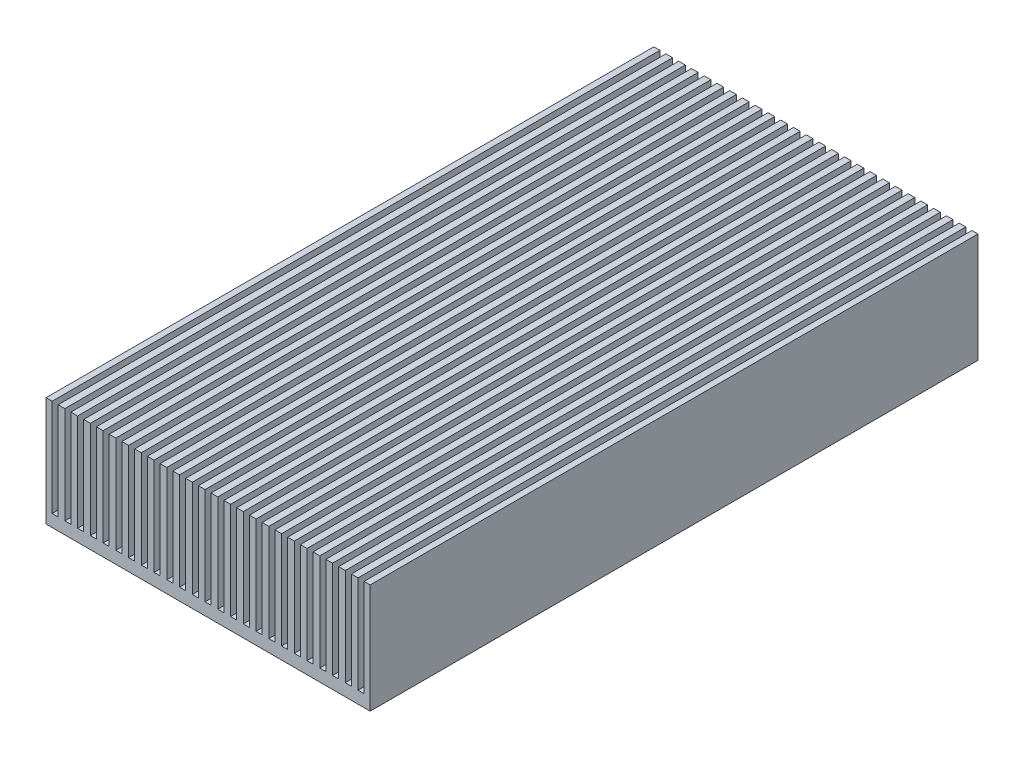
from build123d import *

# Parameters (mm, degrees)
SKETCH1_W           = 80
SKETCH1_H           = 150
BOSS_EXTRUDE1_DEPTH = 27
SKETCH2_W           = 1.5
SKETCH2_H           = 150
CUT_EXTRUDE1_DEPTH  = 24


with BuildPart() as part:
    # Sketch1 → Boss-Extrude1 (new body)
    with BuildSketch(Plane(origin=(0, 0, 0), x_dir=(1, 0, 0), z_dir=(0, 1, 0))):
        with Locations((40, 75)):
            Rectangle(SKETCH1_W, SKETCH1_H)
    extrude(amount=BOSS_EXTRUDE1_DEPTH)

    # Sketch2 → Cut-Extrude1 (cut)
    with BuildSketch(Plane(origin=(0, 27, 0), x_dir=(1, 0, 0), z_dir=(0, 1, 0))):
        with Locations((2.25, 75)):
            Rectangle(SKETCH2_W, SKETCH2_H)
        with Locations((5.395833333, 75)):
            Rectangle(SKETCH2_W, SKETCH2_H)
        with Locations((8.541666667, 75)):
            Rectangle(SKETCH2_W, SKETCH2_H)
        with Locations((11.6875, 75)):
            Rectangle(SKETCH2_W, SKETCH2_H)
        with Locations((14.833333333, 75)):
            Rectangle(SKETCH2_W, SKETCH2_H)
        with Locations((17.979166667, 75)):
            Rectangle(SKETCH2_W, SKETCH2_H)
        with Locations((21.125, 75)):
            Rectangle(SKETCH2_W, SKETCH2_H)
        with Locations((24.270833333, 75)):
            Rectangle(SKETCH2_W, SKETCH2_H)
        with Locations((27.416666667, 75)):
            Rectangle(SKETCH2_W, SKETCH2_H)
        with Locations((30.5625, 75)):
            Rectangle(SKETCH2_W, SKETCH2_H)
        with Locations((33.708333333, 75)):
            Rectangle(SKETCH2_W, SKETCH2_H)
        with Locations((36.854166667, 75)):
            Rectangle(SKETCH2_W, SKETCH2_H)
        with Locations((40, 75)):
            Rectangle(SKETCH2_W, SKETCH2_H)
        with Locations((43.145833333, 75)):
            Rectangle(SKETCH2_W, SKETCH2_H)
        with Locations((46.291666667, 75)):
            Rectangle(SKETCH2_W, SKETCH2_H)
        with Locations((49.4375, 75)):
            Rectangle(SKETCH2_W, SKETCH2_H)
        with Locations((52.583333333, 75)):
            Rectangle(SKETCH2_W, SKETCH2_H)
        with Locations((55.729166667, 75)):
            Rectangle(SKETCH2_W, SKETCH2_H)
        with Locations((58.875, 75)):
            Rectangle(SKETCH2_W, SKETCH2_H)
        with Locations((62.020833333, 75)):
            Rectangle(SKETCH2_W, SKETCH2_H)
        with Locations((65.166666667, 75)):
            Rectangle(SKETCH2_W, SKETCH2_H)
        with Locations((68.3125, 75)):
            Rectangle(SKETCH2_W, SKETCH2_H)
        with Locations((71.458333333, 75)):
            Rectangle(SKETCH2_W, SKETCH2_H)
        with Locations((74.604166667, 75)):
            Rectangle(SKETCH2_W, SKETCH2_H)
        with Locations((77.75, 75)):
            Rectangle(SKETCH2_W, SKETCH2_H)
    extrude(amount=-CUT_EXTRUDE1_DEPTH, mode=Mode.SUBTRACT)


solid = part.part
